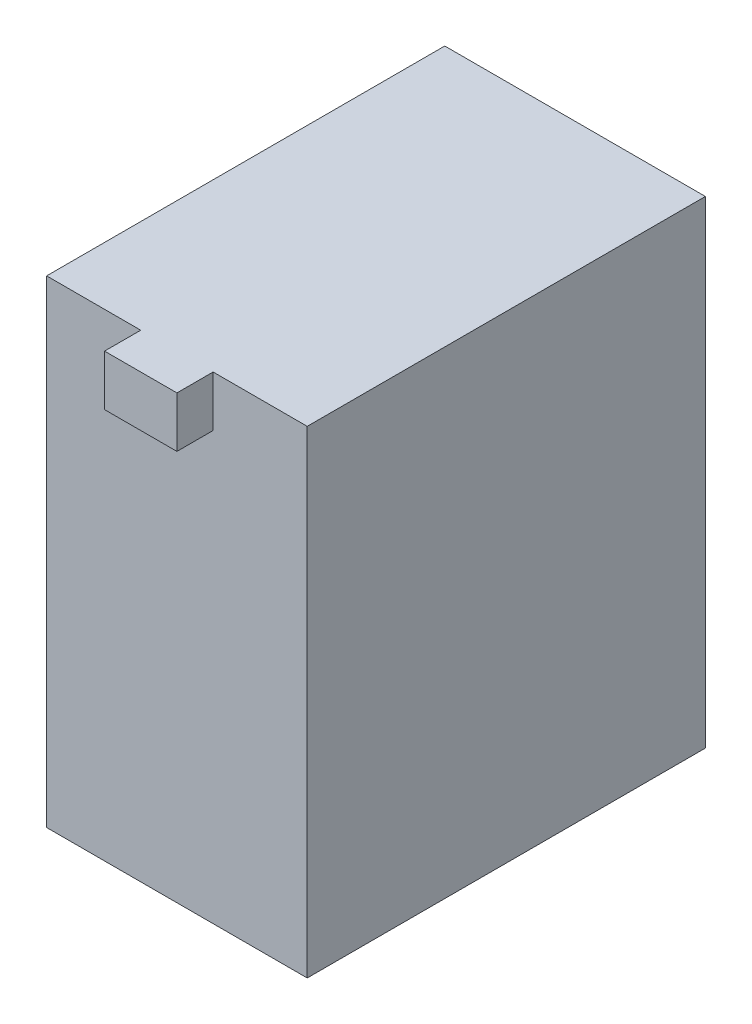
from build123d import *

# Parameters (mm, degrees)
SKETCH_1_W      = 36
SKETCH_1_H      = 55
EXTRUDE_1_DEPTH = 66
SKETCH_2_W      = 10
SKETCH_2_H      = 7
EXTRUDE_2_DEPTH = 5


with BuildPart() as part:
    # 草图1 → 凸台-拉伸1 (new body)
    with BuildSketch(Plane(origin=(0, 0, 0), x_dir=(1, 0, 0), z_dir=(0, 1, 0))):
        Rectangle(SKETCH_1_W, SKETCH_1_H)
    extrude(amount=EXTRUDE_1_DEPTH)

    # 草图2 → 凸台-拉伸2 (add)
    with BuildSketch(Plane.XY.offset(27.5)):
        with Locations((0, 62.5)):
            Rectangle(SKETCH_2_W, SKETCH_2_H)
    extrude(amount=EXTRUDE_2_DEPTH)


solid = part.part
